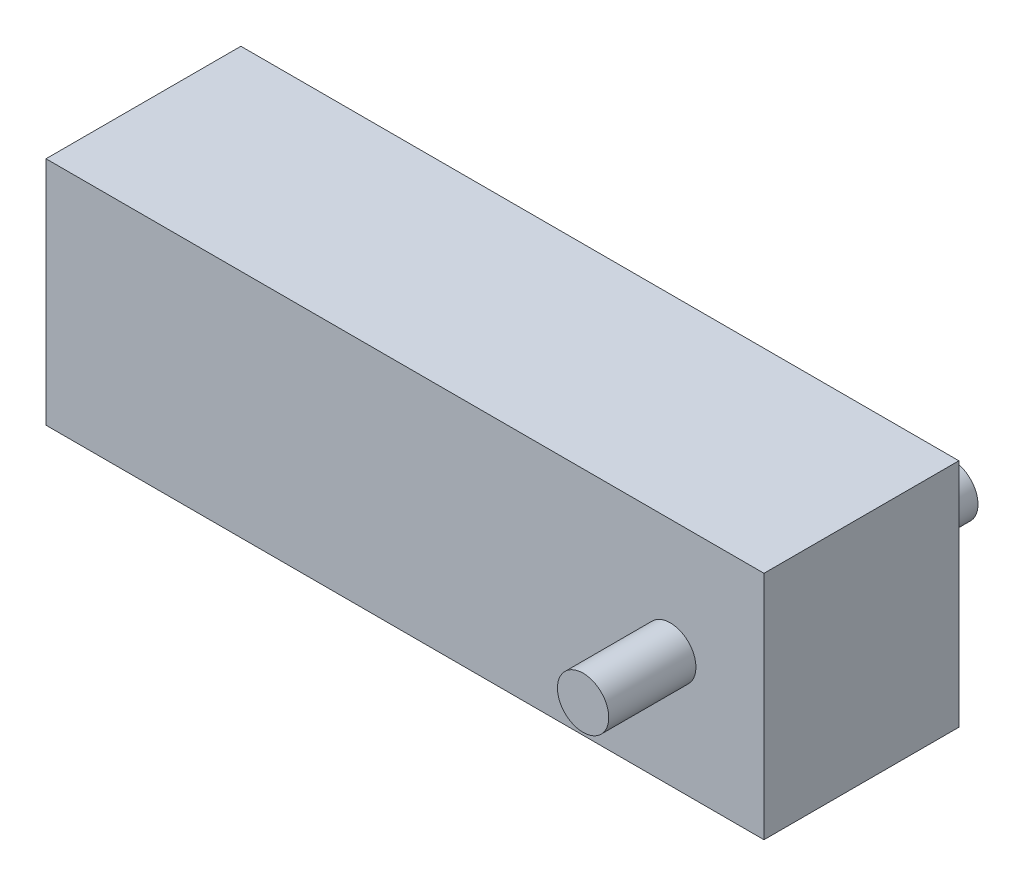
from build123d import *

# Parameters (mm, degrees)
SKETCH_1_W      = 70
SKETCH_1_H      = 22.5
EXTRUDE_1_DEPTH = 9.5
SKETCH_2_R      = 2.5
EXTRUDE_2_DEPTH = 8.5


with BuildPart() as part:
    # 草图1 → 凸台-拉伸1 (new, symmetric)
    with BuildSketch(Plane.XY):
        Rectangle(SKETCH_1_W, SKETCH_1_H)
    extrude(amount=EXTRUDE_1_DEPTH, both=True)

    # 草图2 → 凸台-拉伸2 (add)
    with BuildSketch(Plane.XY.offset(9.5)):
        with Locations(Location((25.865182866, 0, 0), (0, 0, 180))):
            Circle(SKETCH_2_R)
    extrude_2 = extrude(amount=EXTRUDE_2_DEPTH)

    # 镜向1: 凸台-拉伸2 across plane
    add(extrude_2.mirror(Plane.XY))


solid = part.part
